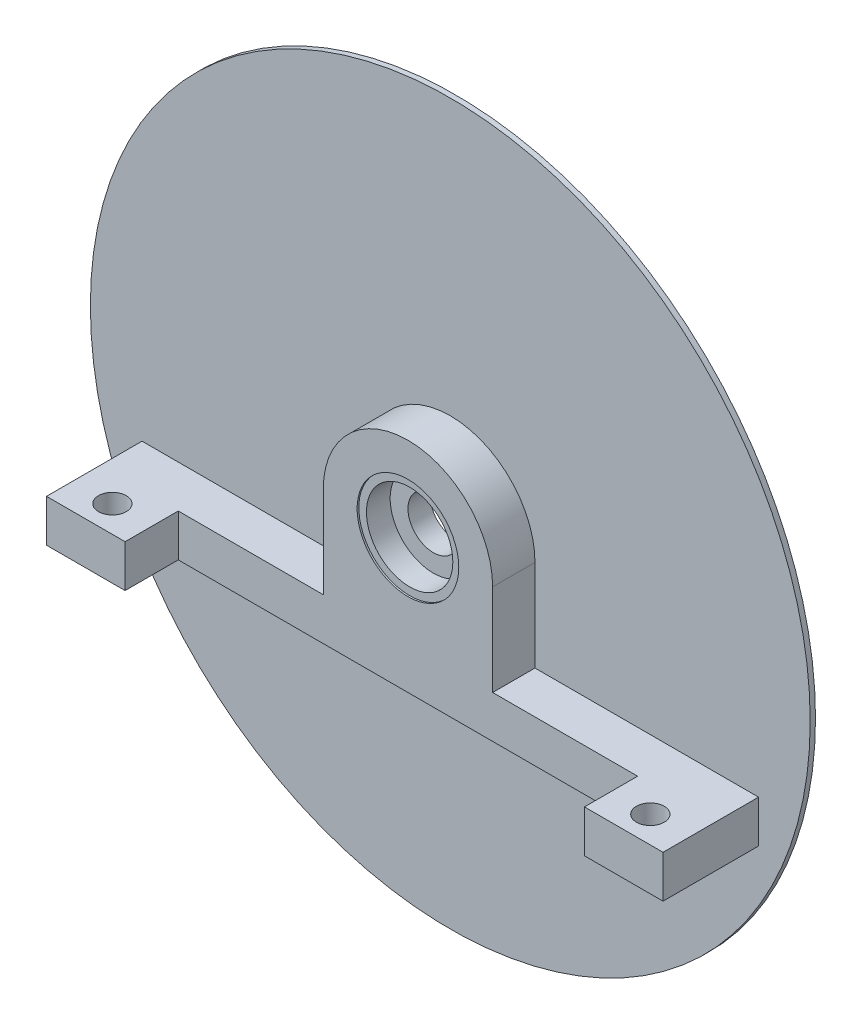
from build123d import *

# Parameters (mm, degrees)
SKETCH1_R           = 3.81
BOSS_EXTRUDE1_DEPTH = 3.175
SKETCH2_R           = 6.477
CUT_EXTRUDE1_DEPTH  = 3.81
SKETCH3_R           = 7.62
CUT_EXTRUDE2_DEPTH  = 0.254
SKETCH6_W           = 11.7856
SKETCH6_H           = 6.35
BOSS_EXTRUDE2_DEPTH = 7.9756
SKETCH7_R           = 2.0828
CUT_EXTRUDE4_DEPTH  = 55.398243725
BOSS_EXTRUDE4_START = 0.79375
SKETCH8_R           = 53.975
SKETCH8_R_2         = 3.81
BOSS_EXTRUDE4_DEPTH = 0.79375


with BuildPart() as part:
    # Sketch1 → Boss-Extrude1 (new, symmetric)
    with BuildSketch(Plane.XY):
        with BuildLine():
            Line((-12.7, 0), (-12.7, -13.716))
            Line((-12.7, -13.716), (-46.228, -13.716))
            Line((-46.228, -13.716), (-46.228, -20.066))
            Line((-46.228, -20.066), (46.228, -20.066))
            Line((46.228, -20.066), (46.228, -13.716))
            Line((46.228, -13.716), (12.7, -13.716))
            Line((12.7, -13.716), (12.7, 0))
            ThreePointArc((12.7, 0), (0, 12.7), (-12.7, 0))
        make_face()
        Circle(SKETCH1_R, mode=Mode.SUBTRACT)
    extrude(amount=BOSS_EXTRUDE1_DEPTH, both=True)

    # Sketch2 → Cut-Extrude1 (cut)
    with BuildSketch(Plane.XY.offset(3.175)):
        Circle(SKETCH2_R)
    extrude(amount=-CUT_EXTRUDE1_DEPTH, mode=Mode.SUBTRACT)

    # Sketch3 → Cut-Extrude2 (cut)
    with BuildSketch(Plane.XY.offset(3.175)):
        Circle(SKETCH3_R)
    extrude(amount=-CUT_EXTRUDE2_DEPTH, mode=Mode.SUBTRACT)

    # Sketch6 → Boss-Extrude2 (add)
    with BuildSketch(Plane.XY.offset(3.175)):
        with Locations((-40.3352, -16.891)):
            Rectangle(SKETCH6_W, SKETCH6_H)
    boss_extrude2 = extrude(amount=BOSS_EXTRUDE2_DEPTH)

    # Sketch7 → Cut-Extrude4 (cut, through all)
    with BuildSketch(Plane(origin=(0, -13.716, 0), x_dir=(1, 0, 0), z_dir=(0, 1, 0))):
        with Locations(Location((-40.3352, -7.1628, 0), (0, 0, 180))):
            Circle(SKETCH7_R)
    cut_extrude4 = extrude(amount=-CUT_EXTRUDE4_DEPTH, mode=Mode.SUBTRACT)

    # Mirror2: Boss-Extrude2, Cut-Extrude4 across plane
    add(boss_extrude2.mirror(Plane(origin=(0, 0, 0), x_dir=(0, 0, 1), z_dir=(1, 0, 0))))
    add(cut_extrude4.mirror(Plane(origin=(0, 0, 0), x_dir=(0, 0, 1), z_dir=(1, 0, 0))), mode=Mode.SUBTRACT)

    # Sketch8 → Boss-Extrude4 (add)
    with BuildSketch(Plane(origin=(0, 0, -3.175), x_dir=(-1, 0, 0), z_dir=(0, 0, -1)).offset(BOSS_EXTRUDE4_START)):
        Circle(SKETCH8_R)
        Circle(SKETCH8_R_2, mode=Mode.SUBTRACT)
    extrude(amount=-BOSS_EXTRUDE4_DEPTH)


solid = part.part
